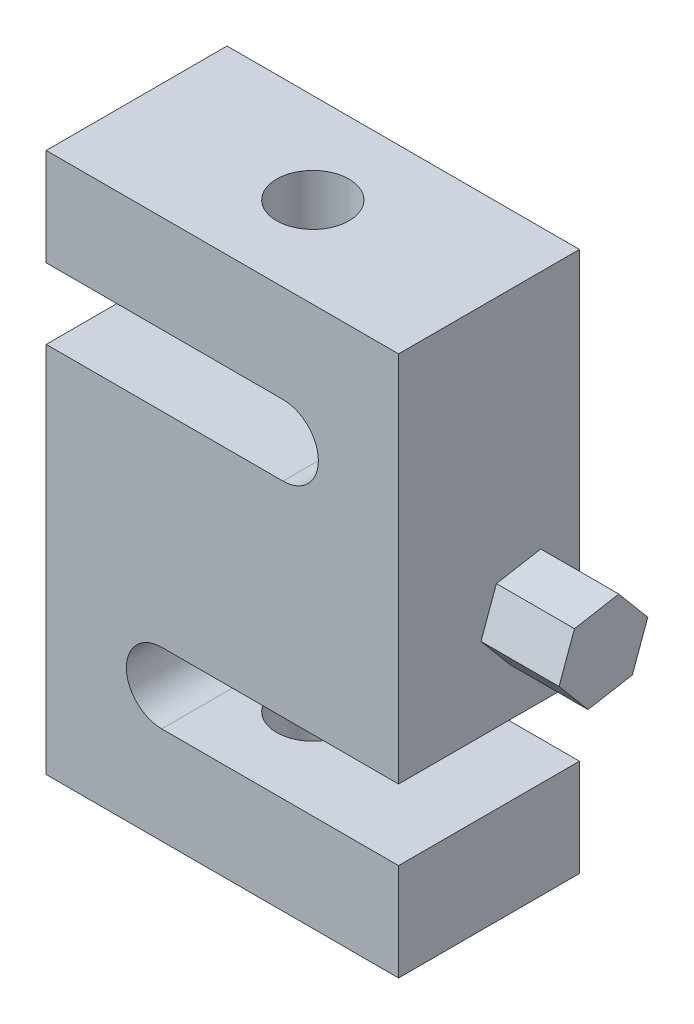
from build123d import *

# Parameters (mm, degrees)
BOSS_EXTRUDE1_DEPTH               = 25.4889
BOSS_EXTRUDE2_DEPTH               = 10.9982
TAP_DRILL_FOR_M12X1_75_TAP1_D     = 10.2
TAP_DRILL_FOR_M12X1_75_TAP1_DEPTH = 19.05
TAP_DRILL_FOR_M12X1_75_TAP1_TIP   = 3.064389157
TAP_DRILL_FOR_M12X1_75_TAP2_D     = 10.2
TAP_DRILL_FOR_M12X1_75_TAP2_DEPTH = 19.05
TAP_DRILL_FOR_M12X1_75_TAP2_TIP   = 3.064389157


with BuildPart() as part:
    # Sketch1 → Boss-Extrude1 (new body)
    with BuildSketch(Plane.XY):
        with BuildLine():
            Line((-24.8285, -38.0873), (24.8285, -38.0873))
            Line((24.8285, -38.0873), (24.8285, -24.3713))
            Line((24.8285, -24.3713), (-8.5471, -24.3713))
            ThreePointArc((-8.5471, -24.3713), (-13.5255, -19.3929), (-8.5471, -14.4145))
            Line((-8.5471, -14.4145), (24.8285, -14.4145))
            Line((24.8285, -14.4145), (24.8285, 38.0873))
            Line((24.8285, 38.0873), (-24.8285, 38.0873))
            Line((-24.8285, 38.0873), (-24.8285, 24.3713))
            Line((-24.8285, 24.3713), (8.5471, 24.3713))
            ThreePointArc((8.5471, 24.3713), (13.5255, 19.3929), (8.5471, 14.4145))
            Line((8.5471, 14.4145), (-24.8285, 14.4145))
            Line((-24.8285, 14.4145), (-24.8285, -38.0873))
        make_face()
    extrude(amount=BOSS_EXTRUDE1_DEPTH)

    # Sketch2 → Boss-Extrude2 (add)
    with BuildSketch(Plane(origin=(24.8285, 0, 0), x_dir=(0, 0, -1), z_dir=(1, 0, 0))):
        Polygon((-11.700587864, 3.150816299), (-13.873781444, -2.815734603), (-9.79319358, -7.681050902), (-3.539412136, -6.579816299), (-1.366218556, -0.613265397), (-5.44680642, 4.252050902), align=None)
    extrude(amount=BOSS_EXTRUDE2_DEPTH)

    # Tap Drill for M12x1.75 Tap1
    with Locations(Plane(origin=(0, 38.0873, 0), x_dir=(1, 0, 0), z_dir=(0, 1, 0))):
        with Locations((0, -12.74445)):
            Hole(TAP_DRILL_FOR_M12X1_75_TAP1_D / 2, depth=TAP_DRILL_FOR_M12X1_75_TAP1_DEPTH)
            with Locations((0, 0, -(TAP_DRILL_FOR_M12X1_75_TAP1_DEPTH + TAP_DRILL_FOR_M12X1_75_TAP1_TIP / 2))):  # 118° drill point
                Cone(0, TAP_DRILL_FOR_M12X1_75_TAP1_D / 2, TAP_DRILL_FOR_M12X1_75_TAP1_TIP, mode=Mode.SUBTRACT)

    # Tap Drill for M12x1.75 Tap2
    with Locations(Plane(origin=(0, -38.0873, 0), x_dir=(-1, 0, 0), z_dir=(0, -1, 0))):
        with Locations((0, -12.74445)):
            Hole(TAP_DRILL_FOR_M12X1_75_TAP2_D / 2, depth=TAP_DRILL_FOR_M12X1_75_TAP2_DEPTH)
            with Locations((0, 0, -(TAP_DRILL_FOR_M12X1_75_TAP2_DEPTH + TAP_DRILL_FOR_M12X1_75_TAP2_TIP / 2))):  # 118° drill point
                Cone(0, TAP_DRILL_FOR_M12X1_75_TAP2_D / 2, TAP_DRILL_FOR_M12X1_75_TAP2_TIP, mode=Mode.SUBTRACT)


solid = part.part
